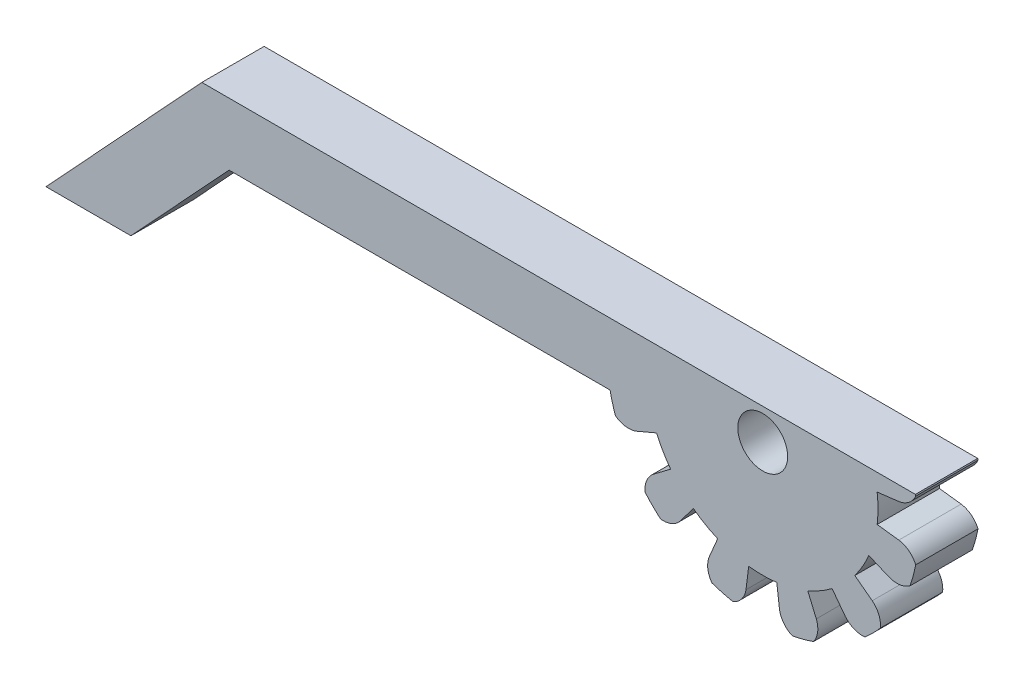
from build123d import *

# Parameters (mm, degrees)
SKETCH1_R           = 4
BOSS_EXTRUDE1_DEPTH = 10


with BuildPart() as part:
    # Sketch1 → Boss-Extrude1 (new body)
    with BuildSketch(Plane.XY):
        with BuildLine():
            Line((24.494897428, 149.96344327), (-90, 149.96344327))
            Line((-90, 149.96344327), (-115, 122.96344327))
            Line((-115, 122.96344327), (-101.371578153, 122.96344327))
            Line((-101.371578153, 122.96344327), (-85.630837413, 139.96344327))
            Line((-85.630837413, 139.96344327), (-24.494897428, 139.96344327))
            ThreePointArc((-24.494897428, 139.96344327), (-24.117560965, 138.379883968), (-23.63796439, 136.824239409))
            ThreePointArc((-23.63796439, 136.824239409), (-22.00386591, 136.155983342), (-20.251106776, 136.367358443))
            Line((-20.251106776, 136.367358443), (-17.029339789, 137.734917393))
            ThreePointArc((-17.029339789, 137.734917393), (-16.02146997, 135.71344327), (-14.774756936, 133.829865342))
            Line((-14.774756936, 133.829865342), (-17.569981221, 131.723512761))
            ThreePointArc((-17.569981221, 131.723512761), (-18.629416995, 130.311266375), (-18.867739506, 128.561967545))
            ThreePointArc((-18.867739506, 128.561967545), (-17.67766953, 127.28577374), (-16.401475725, 126.095703764))
            ThreePointArc((-16.401475725, 126.095703764), (-14.652176895, 126.334026275), (-13.239930509, 127.393462049))
            Line((-13.239930509, 127.393462049), (-11.133577928, 130.188686334))
            ThreePointArc((-11.133577928, 130.188686334), (-9.25, 128.9419733), (-7.228525877, 127.934103481))
            Line((-7.228525877, 127.934103481), (-8.596084827, 124.712336494))
            ThreePointArc((-8.596084827, 124.712336494), (-8.807459928, 122.95957736), (-8.139203861, 121.32547888))
            ThreePointArc((-8.139203861, 121.32547888), (-6.470476128, 120.815297613), (-4.770224884, 120.422763684))
            ThreePointArc((-4.770224884, 120.422763684), (-3.374448914, 121.503806447), (-2.681125555, 123.127427934))
            Line((-2.681125555, 123.127427934), (-2.254582853, 126.601339465))
            ThreePointArc((-2.254582853, 126.601339465), (0, 126.46344327), (2.254582853, 126.601339465))
            Line((2.254582853, 126.601339465), (2.681125555, 123.127427934))
            ThreePointArc((2.681125555, 123.127427934), (3.374448914, 121.503806447), (4.770224884, 120.422763684))
            ThreePointArc((4.770224884, 120.422763684), (6.470476128, 120.815297613), (8.139203861, 121.32547888))
            ThreePointArc((8.139203861, 121.32547888), (8.807459928, 122.95957736), (8.596084827, 124.712336494))
            Line((8.596084827, 124.712336494), (7.228525877, 127.934103481))
            ThreePointArc((7.228525877, 127.934103481), (9.25, 128.9419733), (11.133577928, 130.188686334))
            Line((11.133577928, 130.188686334), (13.239930509, 127.393462049))
            ThreePointArc((13.239930509, 127.393462049), (14.652176895, 126.334026275), (16.401475725, 126.095703764))
            ThreePointArc((16.401475725, 126.095703764), (17.67766953, 127.28577374), (18.867739506, 128.561967545))
            ThreePointArc((18.867739506, 128.561967545), (18.629416995, 130.311266375), (17.569981221, 131.723512761))
            Line((17.569981221, 131.723512761), (14.774756936, 133.829865342))
            ThreePointArc((14.774756936, 133.829865342), (16.02146997, 135.71344327), (17.029339789, 137.734917393))
            Line((17.029339789, 137.734917393), (20.251106776, 136.367358443))
            ThreePointArc((20.251106776, 136.367358443), (22.00386591, 136.155983342), (23.63796439, 136.824239409))
            ThreePointArc((23.63796439, 136.824239409), (24.148145657, 138.492967142), (24.540679586, 140.193218386))
            ThreePointArc((24.540679586, 140.193218386), (23.459636823, 141.588994356), (21.836015336, 142.282317715))
            Line((21.836015336, 142.282317715), (18.362103805, 142.708860417))
            ThreePointArc((18.362103805, 142.708860417), (18.5, 144.96344327), (18.362103805, 147.218026123))
            Line((18.362103805, 147.218026123), (21.836015336, 147.644568825))
            ThreePointArc((21.836015336, 147.644568825), (23.459636823, 148.337892184), (24.540679586, 149.733668154))
            ThreePointArc((24.540679586, 149.733668154), (24.518057681, 149.848609344), (24.494897428, 149.96344327))
        make_face()
        with Locations((0, 144.96344327)):
            Circle(SKETCH1_R, mode=Mode.SUBTRACT)
    extrude(amount=BOSS_EXTRUDE1_DEPTH)


solid = part.part
